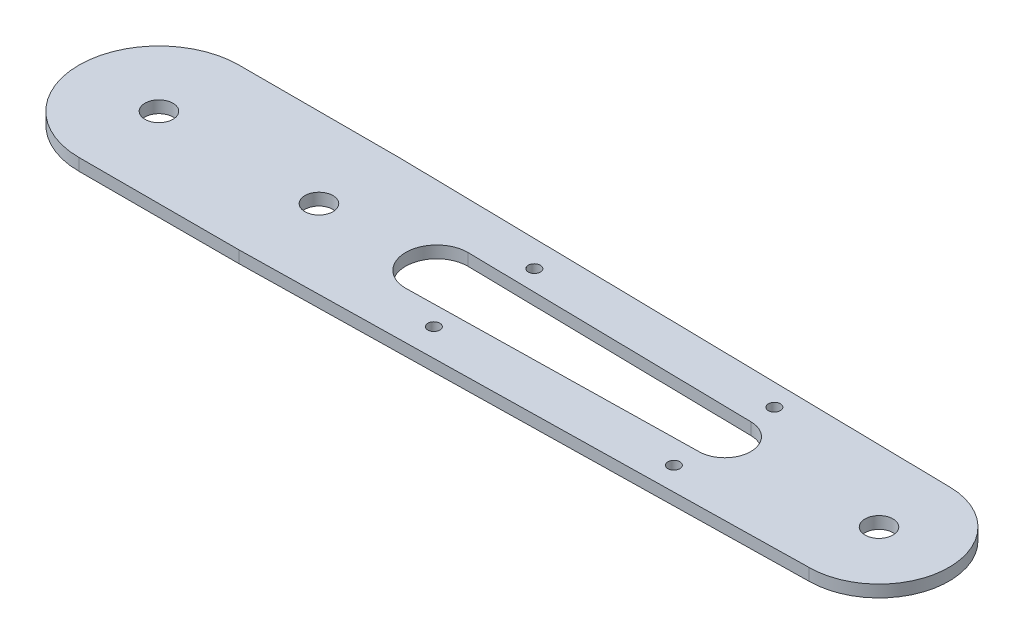
from build123d import *

# Parameters (mm, degrees)
BOSS_EXTRUDE1_DEPTH = 3
SKETCH2_R           = 3.5
CUT_EXTRUDE1_DEPTH  = 159.793104384
CUT_EXTRUDE3_DEPTH  = 159.793104384
BOSS_EXTRUDE2_START = -3
SKETCH10_R          = 3.5
BOSS_EXTRUDE2_DEPTH = 3
SKETCH11_R          = 1.5
CUT_EXTRUDE4_DEPTH  = 10


with BuildPart() as part:
    # Sketch1 → Boss-Extrude1 (new body)
    with BuildSketch(Plane(origin=(0, 0, 0), x_dir=(1, 0, 0), z_dir=(0, 1, 0))):
        with BuildLine():
            Line((140.3125, 17.497209599), (0.357142857, 19.99681097))
            ThreePointArc((0.357142857, 19.99681097), (-19.999202727, 0.178578547), (0, -20))
            Line((0, -20), (140, -17.5))
            ThreePointArc((140, -17.5), (157.499302386, -0.156256229), (140.3125, 17.497209599))
        make_face()
    extrude(amount=BOSS_EXTRUDE1_DEPTH)

    # Sketch2 → Cut-Extrude1 (cut, through all)
    with BuildSketch(Plane(origin=(0, 3, 0), x_dir=(1, 0, 0), z_dir=(0, 1, 0))):
        with Locations(Location((0, 0, 0), (0, 0, 270))):
            Circle(SKETCH2_R)
        with Locations(Location((140, 0, 0), (0, 0, 270))):
            Circle(SKETCH2_R)
    extrude(amount=-CUT_EXTRUDE1_DEPTH, mode=Mode.SUBTRACT)

    # Sketch4 → Cut-Extrude3 (cut, through all)
    with BuildSketch(Plane(origin=(0, 3, 0), x_dir=(1, 0, 0), z_dir=(0, 1, 0))):
        with BuildLine():
            ThreePointArc((101.494647455, -6.185682468), (107.64017994, 0.394224207), (101.283865867, 6.770744637))
            Line((101.283865867, 6.770744637), (29.173044697, 8.058643229))
            ThreePointArc((29.173044697, 8.058643229), (21.397292905, 0.29833633), (29.157599804, -7.477415462))
            Line((29.157599804, -7.477415462), (101.052392136, -6.193579885))
            Line((101.052392136, -6.193579885), (101.494647455, -6.185682468))
        make_face()
    extrude(amount=-CUT_EXTRUDE3_DEPTH, mode=Mode.SUBTRACT)

    # Sketch10 → Boss-Extrude2 (add)
    with BuildSketch(Plane(origin=(0, 3, 0), x_dir=(1, 0, 0), z_dir=(0, 1, 0)).offset(BOSS_EXTRUDE2_START)):
        with BuildLine():
            Line((-0.353982548, 19.996867164), (-39.998419596, 19.999999875))
            Line((-39.998419596, 19.999999875), (-40, 20))
            ThreePointArc((-40, 19.999999938), (-59.999999938, -3.1e-08), (-40, -20))
            Line((-40, -20), (0, -20))
            ThreePointArc((0, -20), (-19.999216776, -0.176998206), (-0.353982548, 19.996867164))
        make_face()
        with Locations(Location((-40, 0, 0), (0, 0, 270))):
            Circle(SKETCH10_R, mode=Mode.SUBTRACT)
    extrude(amount=BOSS_EXTRUDE2_DEPTH)

    # Sketch11 → Cut-Extrude4 (cut)
    with BuildSketch(Plane(origin=(0, 3, 0), x_dir=(1, 0, 0), z_dir=(0, 1, 0))):
        with Locations(Location((40.994069635, 12.848317219, 0), (0, 0, 270))):
            Circle(SKETCH11_R)
        with Locations(Location((40.994069635, -12.26684706, 0), (0, 0, 270))):
            Circle(SKETCH11_R)
        with Locations(Location((100.994069635, -12.26684706, 0), (0, 0, 270))):
            Circle(SKETCH11_R)
        with Locations(Location((100.994069635, 12.848317219, 0), (0, 0, 270))):
            Circle(SKETCH11_R)
    extrude(amount=-CUT_EXTRUDE4_DEPTH, mode=Mode.SUBTRACT)


solid = part.part
